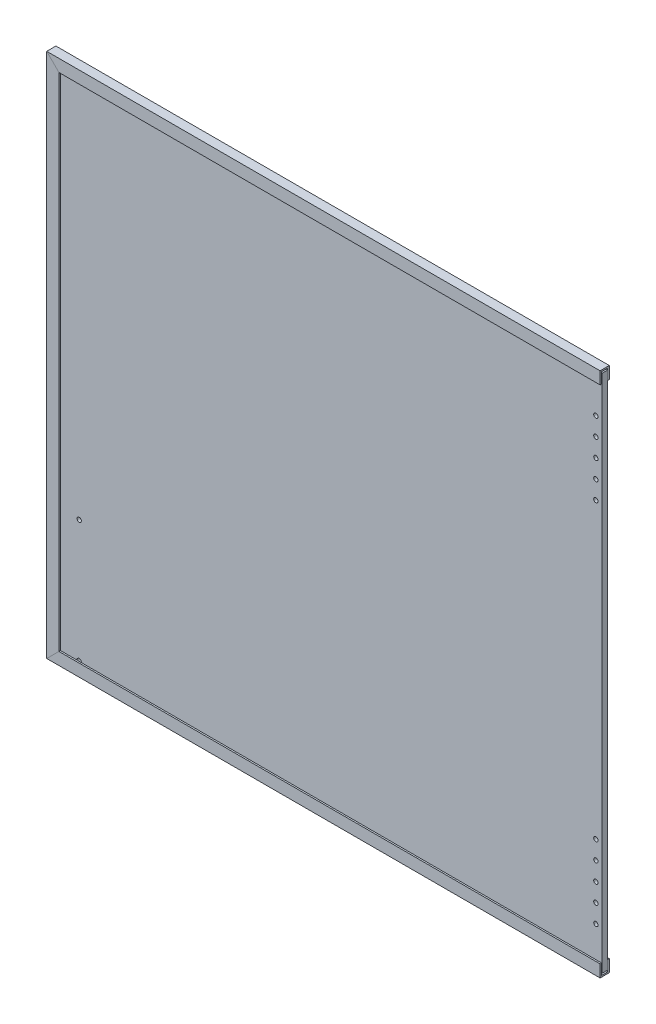
from build123d import *

# Parameters (mm, degrees)
SKETCH2_W                             = 574.675
SKETCH2_H                             = 546.1
FRAME_OUTER_DIMENSIONS_DEPTH          = 4.7625
SKETCH3_W                             = 561.975
SKETCH3_H                             = 520.7
FRAME_INNER_DIMENSIONS_DEPTH          = 787.458459249
FRAME_PROFILE_DEPTH                   = 3.175
FRAME_PROFILE_DEPTH_BACK              = 3.175
SKETCH4_W                             = 573.0875
SKETCH4_H                             = 542.925
FRAME_SECTION_SPLIT_SURFACE_1_1_BACK  = 793.822
FRAME_SECTION_SPLIT_SURFACE_1_1_DEPTH = 1587.644
FRAME_SECTION_SPLIT_SURFACE_1_2_BACK  = 793.822
FRAME_SECTION_SPLIT_SURFACE_1_2_DEPTH = 1587.644
FRAME_SECTION_SPLIT_SURFACE_2_3_BACK  = 793.822
FRAME_SECTION_SPLIT_SURFACE_2_3_DEPTH = 1587.644
FRAME_SECTION_SPLIT_SURFACE_2_4_BACK  = 793.822
FRAME_SECTION_SPLIT_SURFACE_2_4_DEPTH = 1587.644
SKETCH5_W                             = 571.5
SKETCH5_H                             = 539.75
DOOR_PANEL_DEPTH                      = 2.794
SKETCH9_W                             = 2.2479
SKETCH9_H                             = 7.5565
F_8_CLEARANCE_HOLE1_AT_2_COUNT        = 2
F_8_CLEARANCE_HOLE1_AT_2_PITCH        = 19.05
F_8_CLEARANCE_HOLE1_AT_3_COUNT        = 2
F_8_CLEARANCE_HOLE1_AT_3_PITCH        = 38.1
F_8_CLEARANCE_HOLE1_AT_4_COUNT        = 2
F_8_CLEARANCE_HOLE1_AT_4_PITCH        = 57.15
F_8_CLEARANCE_HOLE1_AT_5_COUNT        = 2
F_8_CLEARANCE_HOLE1_AT_5_PITCH        = 76.2
F_8_CLEARANCE_HOLE1_AT_6_COUNT        = 2
F_8_CLEARANCE_HOLE1_AT_6_PITCH        = 400.05
F_8_CLEARANCE_HOLE1_AT_7_COUNT        = 2
F_8_CLEARANCE_HOLE1_AT_7_PITCH        = 419.1
F_8_CLEARANCE_HOLE1_AT_8_COUNT        = 2
F_8_CLEARANCE_HOLE1_AT_8_PITCH        = 438.15
F_8_CLEARANCE_HOLE1_AT_9_COUNT        = 2
F_8_CLEARANCE_HOLE1_AT_9_PITCH        = 457.2
F_8_CLEARANCE_HOLE1_AT_10_COUNT       = 2
F_8_CLEARANCE_HOLE1_AT_10_PITCH       = 381
SKETCH12_W                            = 2.2479
SKETCH12_H                            = 7.5565
F_8_CLEARANCE_HOLE2_AT_2_COUNT        = 2
F_8_CLEARANCE_HOLE2_AT_2_PITCH        = 127


with BuildPart() as part:
    # Sketch2 → Frame outer dimensions (new, symmetric)
    with BuildSketch(Plane.XY):
        with Locations((290.5125, 260.35)):
            Rectangle(SKETCH2_W, SKETCH2_H)
    extrude(amount=FRAME_OUTER_DIMENSIONS_DEPTH, both=True)

    # Sketch3 → Frame inner dimensions (cut, through all)
    with BuildSketch(Plane.XY.offset(4.7625)):
        with Locations((296.8625, 260.35)):
            Rectangle(SKETCH3_W, SKETCH3_H)
    extrude(amount=-FRAME_INNER_DIMENSIONS_DEPTH, mode=Mode.SUBTRACT)

    # Sketch4 → Frame profile (cut, two sides: drawn at the far end of the back side and taken through both)
    with BuildSketch(Plane.XY.offset(-FRAME_PROFILE_DEPTH_BACK)):
        with Locations((291.30625, 260.35)):
            Rectangle(SKETCH4_W, SKETCH4_H)
    extrude(amount=FRAME_PROFILE_DEPTH + FRAME_PROFILE_DEPTH_BACK, mode=Mode.SUBTRACT)


with BuildPart() as body_2:
    # Frame section split: the piece behind the surface
    add(part.part)
    # Frame section split surface 1: a surface, the sketch's curves swept straight by 1587.644 mm
    with BuildLine(Plane.XY.offset(4.7625).offset(-FRAME_SECTION_SPLIT_SURFACE_1_1_BACK), mode=Mode.PRIVATE) as frame_section_split_surface_1_1_path:
        Line((3.175, 533.4), (15.875, 520.7))
    frame_section_split_surface_1_1 = Shell.extrude(frame_section_split_surface_1_1_path.wire(), (0 * FRAME_SECTION_SPLIT_SURFACE_1_1_DEPTH, 0 * FRAME_SECTION_SPLIT_SURFACE_1_1_DEPTH, 1 * FRAME_SECTION_SPLIT_SURFACE_1_1_DEPTH))
    split(bisect_by=frame_section_split_surface_1_1, keep=Keep.BOTTOM)


with BuildPart() as part_1:
    add(part.part)

    # Frame section split: split by a surface, the side it looks to stays
    # Frame section split surface 1: a surface, the sketch's curves swept straight by 1587.644 mm
    with BuildLine(Plane.XY.offset(4.7625).offset(-FRAME_SECTION_SPLIT_SURFACE_1_2_BACK), mode=Mode.PRIVATE) as frame_section_split_surface_1_2_path:
        Line((3.175, 533.4), (15.875, 520.7))
    frame_section_split_surface_1_2 = Shell.extrude(frame_section_split_surface_1_2_path.wire(), (0 * FRAME_SECTION_SPLIT_SURFACE_1_2_DEPTH, 0 * FRAME_SECTION_SPLIT_SURFACE_1_2_DEPTH, 1 * FRAME_SECTION_SPLIT_SURFACE_1_2_DEPTH))
    split(bisect_by=frame_section_split_surface_1_2, keep=Keep.TOP)


with BuildPart() as body_3:
    # Frame section split 2 body 2: the piece behind the surface
    add(body_2.part)
    # Frame section split surface 2: a surface, the sketch's curves swept straight by 1587.644 mm
    with BuildLine(Plane.XY.offset(4.7625).offset(-FRAME_SECTION_SPLIT_SURFACE_2_3_BACK), mode=Mode.PRIVATE) as frame_section_split_surface_2_3_path:
        Line((3.175, -12.7), (15.875, 0))
    frame_section_split_surface_2_3 = Shell.extrude(frame_section_split_surface_2_3_path.wire(), (0 * FRAME_SECTION_SPLIT_SURFACE_2_3_DEPTH, 0 * FRAME_SECTION_SPLIT_SURFACE_2_3_DEPTH, 1 * FRAME_SECTION_SPLIT_SURFACE_2_3_DEPTH))
    split(bisect_by=frame_section_split_surface_2_3, keep=Keep.BOTTOM)


with BuildPart() as body_2_1:
    add(body_2.part)

    # Frame section split 2 body 2: split by a surface, the side it looks to stays
    # Frame section split surface 2: a surface, the sketch's curves swept straight by 1587.644 mm
    with BuildLine(Plane.XY.offset(4.7625).offset(-FRAME_SECTION_SPLIT_SURFACE_2_4_BACK), mode=Mode.PRIVATE) as frame_section_split_surface_2_4_path:
        Line((3.175, -12.7), (15.875, 0))
    frame_section_split_surface_2_4 = Shell.extrude(frame_section_split_surface_2_4_path.wire(), (0 * FRAME_SECTION_SPLIT_SURFACE_2_4_DEPTH, 0 * FRAME_SECTION_SPLIT_SURFACE_2_4_DEPTH, 1 * FRAME_SECTION_SPLIT_SURFACE_2_4_DEPTH))
    split(bisect_by=frame_section_split_surface_2_4, keep=Keep.TOP)


with BuildPart() as body_4:
    # Sketch5 → Door panel (new, symmetric)
    with BuildSketch(Plane.XY):
        with Locations((292.1, 260.35)):
            Rectangle(SKETCH5_W, SKETCH5_H)
    extrude(amount=DOOR_PANEL_DEPTH, both=True)

    # Sketch9 → #8 Clearance Hole1 (revolve, cut)
    with BuildSketch(Plane(origin=(571.5, 31.75, 2.794), x_dir=(0, -1, 0), z_dir=(1, 0, 0))):
        with Locations((1.12395, 3.77825)):
            Rectangle(SKETCH9_W, SKETCH9_H)
    f_8_clearance_hole1 = revolve(axis=Axis((571.5, 31.75, 9.144), (0, 0, -1)), mode=Mode.SUBTRACT)

    # #8 Clearance Hole1 at 2: #8 Clearance Hole1 ×2
    with Locations(*[(0, i * F_8_CLEARANCE_HOLE1_AT_2_PITCH, 0) for i in range(1, F_8_CLEARANCE_HOLE1_AT_2_COUNT)]):
        add(f_8_clearance_hole1, mode=Mode.SUBTRACT)

    # #8 Clearance Hole1 at 3: #8 Clearance Hole1 ×2
    with Locations(*[(0, i * F_8_CLEARANCE_HOLE1_AT_3_PITCH, 0) for i in range(1, F_8_CLEARANCE_HOLE1_AT_3_COUNT)]):
        add(f_8_clearance_hole1, mode=Mode.SUBTRACT)

    # #8 Clearance Hole1 at 4: #8 Clearance Hole1 ×2
    with Locations(*[(0, i * F_8_CLEARANCE_HOLE1_AT_4_PITCH, 0) for i in range(1, F_8_CLEARANCE_HOLE1_AT_4_COUNT)]):
        add(f_8_clearance_hole1, mode=Mode.SUBTRACT)

    # #8 Clearance Hole1 at 5: #8 Clearance Hole1 ×2
    with Locations(*[(0, i * F_8_CLEARANCE_HOLE1_AT_5_PITCH, 0) for i in range(1, F_8_CLEARANCE_HOLE1_AT_5_COUNT)]):
        add(f_8_clearance_hole1, mode=Mode.SUBTRACT)

    # #8 Clearance Hole1 at 6: #8 Clearance Hole1 ×2
    with Locations(*[(0, i * F_8_CLEARANCE_HOLE1_AT_6_PITCH, 0) for i in range(1, F_8_CLEARANCE_HOLE1_AT_6_COUNT)]):
        add(f_8_clearance_hole1, mode=Mode.SUBTRACT)

    # #8 Clearance Hole1 at 7: #8 Clearance Hole1 ×2
    with Locations(*[(0, i * F_8_CLEARANCE_HOLE1_AT_7_PITCH, 0) for i in range(1, F_8_CLEARANCE_HOLE1_AT_7_COUNT)]):
        add(f_8_clearance_hole1, mode=Mode.SUBTRACT)

    # #8 Clearance Hole1 at 8: #8 Clearance Hole1 ×2
    with Locations(*[(0, i * F_8_CLEARANCE_HOLE1_AT_8_PITCH, 0) for i in range(1, F_8_CLEARANCE_HOLE1_AT_8_COUNT)]):
        add(f_8_clearance_hole1, mode=Mode.SUBTRACT)

    # #8 Clearance Hole1 at 9: #8 Clearance Hole1 ×2
    with Locations(*[(0, i * F_8_CLEARANCE_HOLE1_AT_9_PITCH, 0) for i in range(1, F_8_CLEARANCE_HOLE1_AT_9_COUNT)]):
        add(f_8_clearance_hole1, mode=Mode.SUBTRACT)

    # #8 Clearance Hole1 at 10: #8 Clearance Hole1 ×2
    with Locations(*[(0, i * F_8_CLEARANCE_HOLE1_AT_10_PITCH, 0) for i in range(1, F_8_CLEARANCE_HOLE1_AT_10_COUNT)]):
        add(f_8_clearance_hole1, mode=Mode.SUBTRACT)

    # Sketch12 → #8 Clearance Hole2 (revolve, cut)
    with BuildSketch(Plane(origin=(34.925, 0, 2.794), x_dir=(0, -1, 0), z_dir=(1, 0, 0))):
        with Locations((1.12395, 3.77825)):
            Rectangle(SKETCH12_W, SKETCH12_H)
    f_8_clearance_hole2 = revolve(axis=Axis((34.925, 0, 9.144), (0, 0, -1)), mode=Mode.SUBTRACT)

    # #8 Clearance Hole2 at 2: #8 Clearance Hole2 ×2
    with Locations(*[(0, i * F_8_CLEARANCE_HOLE2_AT_2_PITCH, 0) for i in range(1, F_8_CLEARANCE_HOLE2_AT_2_COUNT)]):
        add(f_8_clearance_hole2, mode=Mode.SUBTRACT)


with BuildPart() as body_5:
    # Mirror1: mirrored copy
    add(part_1.part.mirror(Plane(origin=(0, 0, 0), x_dir=(0, 0, 1), z_dir=(1, 0, 0))))


with BuildPart() as body_6:
    # Mirror1 2: mirrored copy
    add(body_2_1.part.mirror(Plane(origin=(0, 0, 0), x_dir=(0, 0, 1), z_dir=(1, 0, 0))))


with BuildPart() as body_7:
    # Mirror1 3: mirrored copy
    add(body_3.part.mirror(Plane(origin=(0, 0, 0), x_dir=(0, 0, 1), z_dir=(1, 0, 0))))


with BuildPart() as body_8:
    # Mirror1 4: mirrored copy
    add(body_4.part.mirror(Plane(origin=(0, 0, 0), x_dir=(0, 0, 1), z_dir=(1, 0, 0))))


solid = Compound([part_1.part, body_3.part, body_2_1.part, body_4.part])
